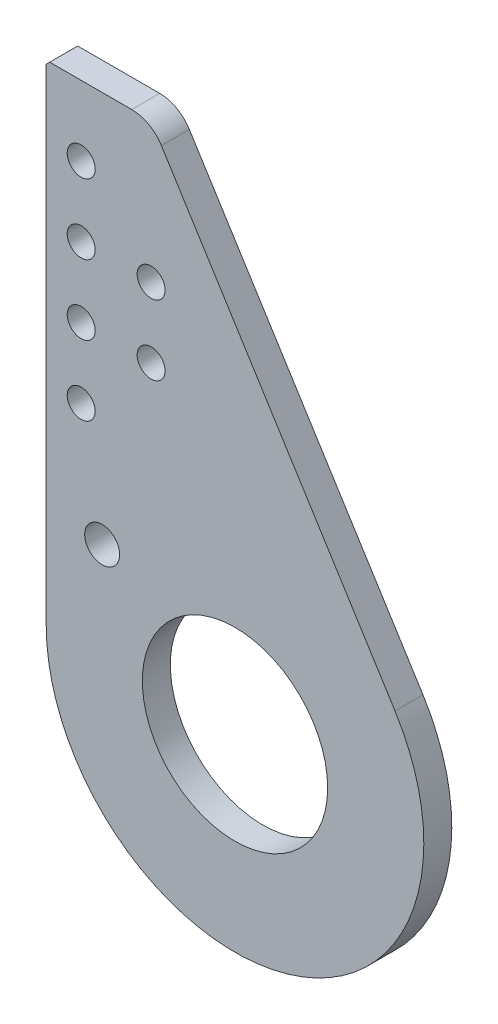
from build123d import *

# Parameters (mm, degrees)
SKETCH_1_R      = 2
SKETCH_1_R_2    = 13.25
SKETCH_1_R_3    = 2.5
EXTRUDE_1_DEPTH = 4
FILLET_1_R      = 5
CHAMFER_1_SIZE  = 0.5


with BuildPart() as part:
    # 草图1 → 凸台-拉伸1 (new body)
    with BuildSketch(Plane.XY):
        with BuildLine():
            Line((-27, 0), (-27, 70))
            Line((-27, 70), (-11.999997176, 70))
            Line((-11.999997176, 70), (22.879375353, 14.336463423))
            ThreePointArc((22.879375353, 14.336463423), (7.458447073, -25.949403987), (-27, 0))
        make_face()
        with Locations((-22, 60)):
            Circle(SKETCH_1_R, mode=Mode.SUBTRACT)
        with Locations((-22, 50)):
            Circle(SKETCH_1_R, mode=Mode.SUBTRACT)
        with Locations((-22, 30)):
            Circle(SKETCH_1_R, mode=Mode.SUBTRACT)
        with Locations((-22, 40)):
            Circle(SKETCH_1_R, mode=Mode.SUBTRACT)
        with Locations((-12, 50)):
            Circle(SKETCH_1_R, mode=Mode.SUBTRACT)
        Circle(SKETCH_1_R_2, mode=Mode.SUBTRACT)
        with Locations((-12, 40)):
            Circle(SKETCH_1_R, mode=Mode.SUBTRACT)
        with Locations((-19, 14)):
            Circle(SKETCH_1_R_3, mode=Mode.SUBTRACT)
    extrude(amount=EXTRUDE_1_DEPTH)

    # 圆角1
    fillet_1_edges = [part.edges().sort_by_distance(p)[0] for p in [
        (-11.999997176, 70, 2),
    ]]
    fillet(fillet_1_edges, radius=FILLET_1_R)

    # 倒角1
    chamfer_1_edges = [part.edges().sort_by_distance(p)[0] for p in [
        (-27, 70, 2),
    ]]
    chamfer(chamfer_1_edges, length=CHAMFER_1_SIZE)


solid = part.part
